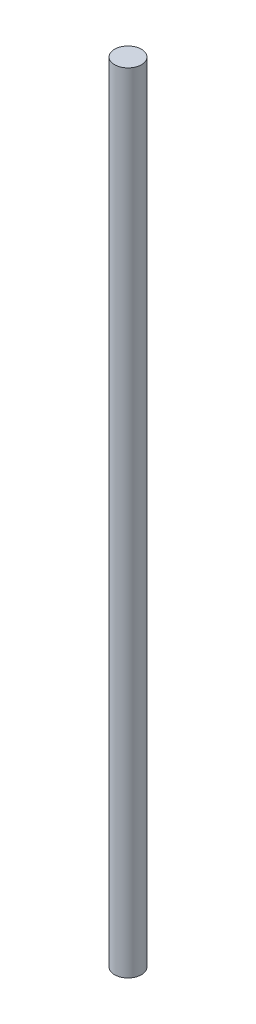
from build123d import *

# Parameters (mm, degrees)
SKETCH_1_R      = 4
EXTRUDE_1_DEPTH = 235


with BuildPart() as part:
    # 草图1 → 凸台-拉伸1 (new body)
    with BuildSketch(Plane(origin=(0, 0, 0), x_dir=(1, 0, 0), z_dir=(0, 1, 0))):
        with Locations(Location((0, 0, 0), (0, 0, 90))):
            Circle(SKETCH_1_R)
    extrude(amount=EXTRUDE_1_DEPTH)


solid = part.part
